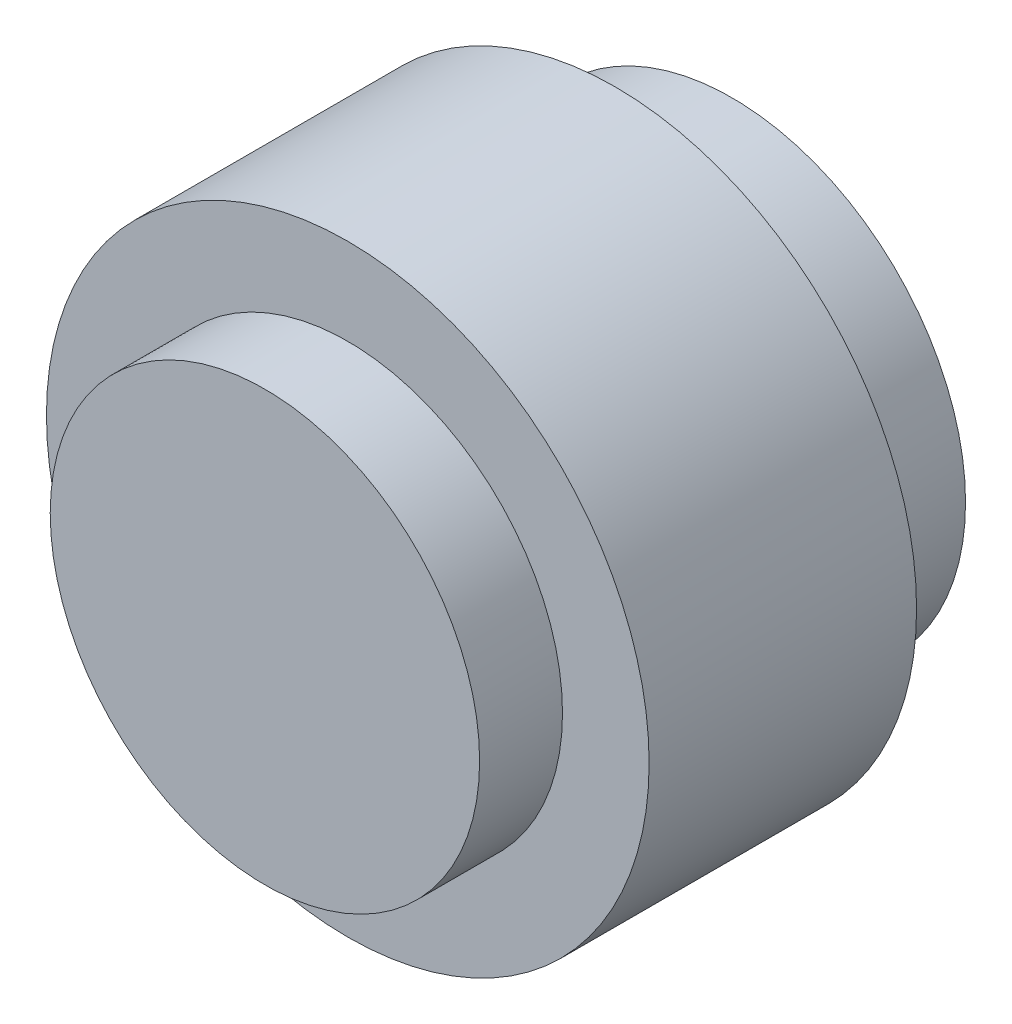
from build123d import *
from build123d.topology import SkipClean

# Parameters (mm, degrees)
SKETCH1_R                   = 28.5
BOSS_EXTRUDE1_DEPTH         = 11
SKETCH1_3_R                 = 40
SKETCH1_3_R_2               = 21
BOSS_EXTRUDE2_DEPTH         = 35.5
M3_TAPPED_HOLE1_D           = 2.5
M3_TAPPED_HOLE1_DEPTH       = 5
M3_TAPPED_HOLE1_CSINK_D     = 3.05
M3_TAPPED_HOLE1_CSINK_ANGLE = 90
M3_TAPPED_HOLE1_TIP         = 0.751075774
SKETCH5_R                   = 31
SKETCH5_R_2                 = 21
BOSS_EXTRUDE3_DEPTH         = 15.5


with BuildPart() as part:
    # Sketch1 → Boss-Extrude1 (new body)
    with BuildSketch(Plane.XY):
        Circle(SKETCH1_R)
    extrude(amount=BOSS_EXTRUDE1_DEPTH)

    # Sketch1<3> → Boss-Extrude2 (add)
    with BuildSketch(Plane.XY):
        Circle(SKETCH1_3_R)
        Circle(SKETCH1_3_R_2, mode=Mode.SUBTRACT)
    extrude(amount=-BOSS_EXTRUDE2_DEPTH)

    # M3 Tapped Hole1
    with Locations(Plane(origin=(0, 0, -35.5), x_dir=(-1, 0, 0), z_dir=(0, 0, -1))):
        with Locations((0, 37), (26.162950904, 26.162950904), (37, 0), (26.162950904, -26.162950904), (0, -37), (-26.162950904, -26.162950904), (-37, 0), (-26.162950904, 26.162950904)):
            CounterSinkHole(M3_TAPPED_HOLE1_D / 2, M3_TAPPED_HOLE1_CSINK_D / 2, depth=M3_TAPPED_HOLE1_DEPTH, counter_sink_angle=M3_TAPPED_HOLE1_CSINK_ANGLE)
            with Locations((0, 0, -(M3_TAPPED_HOLE1_DEPTH + M3_TAPPED_HOLE1_TIP / 2))):  # 118° drill point
                Cone(0, M3_TAPPED_HOLE1_D / 2, M3_TAPPED_HOLE1_TIP, mode=Mode.SUBTRACT)

    # Sketch5 → Boss-Extrude3 (add)
    with SkipClean():  # the faces are left unmerged after this step: merging them gives an invalid solid
        with BuildSketch(Plane(origin=(0, 0, -35.5), x_dir=(-1, 0, 0), z_dir=(0, 0, -1))):
            Circle(SKETCH5_R)
            Circle(SKETCH5_R_2, mode=Mode.SUBTRACT)
        extrude(amount=BOSS_EXTRUDE3_DEPTH)


solid = part.part
